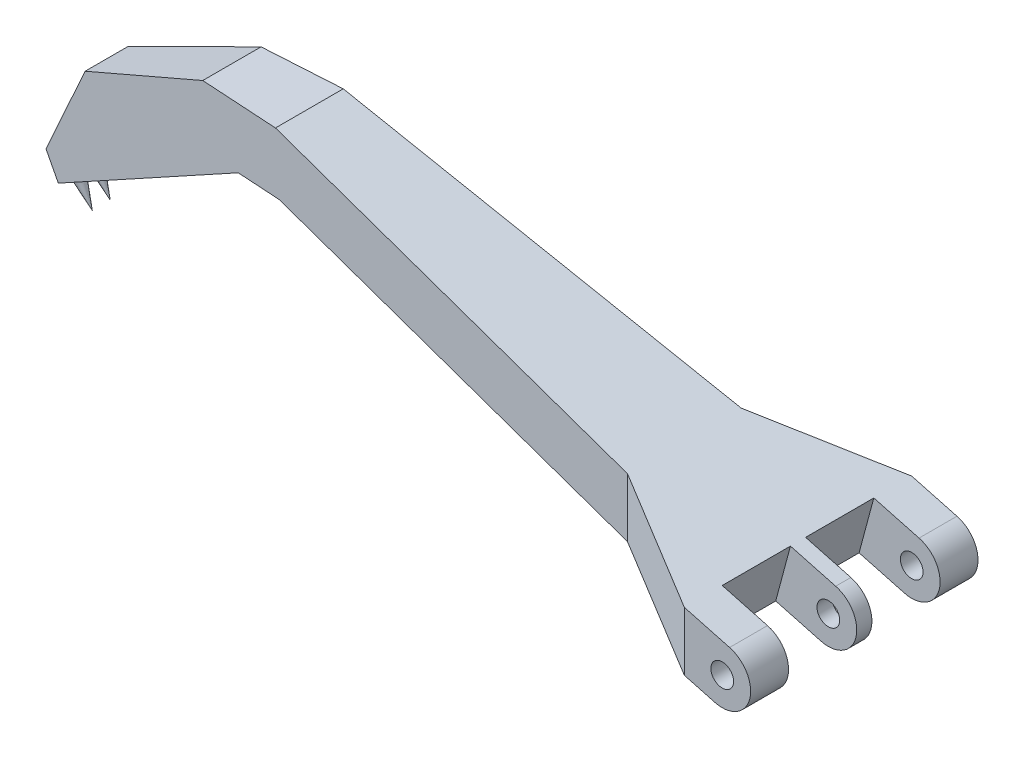
from build123d import *

# Parameters (mm, degrees)
BOSS_EXTRUDE2_DEPTH      = 15
BOSS_EXTRUDE2_DEPTH_BACK = 15
SKETCH3_R                = 1.5
CUT_EXTRUDE2_DEPTH       = 106.264714703
CUT_EXTRUDE2_DEPTH_BACK  = 106.264714703
SKETCH12_OUTSIDE_W       = 130.034
SKETCH12_OUTSIDE_H       = 54.552
BOSS_EXTRUDE3_DEPTH      = 15
BOSS_EXTRUDE3_DEPTH_BACK = 15
SKETCH13_R               = 1.5
CUT_EXTRUDE8_REACH       = 107.495
SKETCH16_W               = 6.181190374
SKETCH16_H               = 9
SKETCH16_W_2             = 3.75


with BuildPart() as part:
    # Sketch3 → Boss-Extrude2 (new, two sides: drawn at the far end of the back side and taken through both)
    with BuildSketch(Plane.XY.offset(-BOSS_EXTRUDE2_DEPTH_BACK)):
        with BuildLine():
            Line((0.970571419, 3.622221849), (-69.482255776, 22.5))
            Line((-69.482255776, 22.5), (-79.701126542, 22.5))
            Line((-79.701126542, 22.5), (-96.234008051, 14.790590741))
            Line((-96.234008051, 14.790590741), (-101.732050808, 3))
            Line((-101.732050808, 3), (-100, 0))
            Line((-100, 0), (-74.714962449, 14.598323237))
            Line((-74.714962449, 14.598323237), (-68.970571419, 14.598323237))
            Line((-68.970571419, 14.598323237), (-0.970571419, -3.622221849))
            ThreePointArc((-0.970571419, -3.622221849), (3.622221849, -0.970571419), (0.970571419, 3.622221849))
        make_face()
        Circle(SKETCH3_R, mode=Mode.SUBTRACT)
    extrude(amount=BOSS_EXTRUDE2_DEPTH + BOSS_EXTRUDE2_DEPTH_BACK)

    # Sketch12 outside → Cut-Extrude2 (cut, two sides: drawn at the far end of the back side and taken through both)
    with BuildSketch(Plane(origin=(0, 0, 0), x_dir=(1, 0, 0), z_dir=(0, 1, 0)).offset(-CUT_EXTRUDE2_DEPTH_BACK)):
        with Locations((-48.991, 0)):
            Rectangle(SKETCH12_OUTSIDE_W, SKETCH12_OUTSIDE_H)
        Polygon((-101.732050808, 2.5), (-101.732050808, -2.5), (-20, -7.5), (-5, -15), (-5, 15), (-20, 7.5), align=None, mode=Mode.SUBTRACT)
    extrude(amount=CUT_EXTRUDE2_DEPTH + CUT_EXTRUDE2_DEPTH_BACK, mode=Mode.SUBTRACT)

    # Sketch13 → Boss-Extrude3 (add, two sides: drawn at the far end of the back side and taken through both)
    with BuildSketch(Plane.XY.offset(-BOSS_EXTRUDE3_DEPTH_BACK)):
        with BuildLine():
            Line((-5, 5.222031639), (-5, -2.542539714))
            Line((-5, -2.542539714), (-0.970571419, -3.622221849))
            ThreePointArc((-0.970571419, -3.622221849), (3.622221849, -0.970571419), (0.970571419, 3.622221849))
            Line((0.970571419, 3.622221849), (-5, 5.222031639))
        make_face()
        Circle(SKETCH13_R, mode=Mode.SUBTRACT)
    extrude(amount=BOSS_EXTRUDE3_DEPTH + BOSS_EXTRUDE3_DEPTH_BACK)

    # Cut-Extrude8: up to this face of the body (flat: up to its plane)
    cut_extrude8_end = Plane(part.part.faces().sort_by_distance((-27.959079365, 3.60932706, 0))[0])
    # Sketch16 → Cut-Extrude8 (cut, up to the picked face)
    with BuildSketch(Plane(origin=(0.970571419, 3.622221849, 0), x_dir=(0.9659258262890683, -0.2588190451025211, 0), z_dir=(0.2588190451025211, 0.9659258262890683, 0)), mode=Mode.PRIVATE) as cut_extrude8_sk1:
        with Locations((-3.090595187, 5.5)):
            Rectangle(SKETCH16_W, SKETCH16_H)
    cut_extrude8_tool1 = split(extrude(cut_extrude8_sk1.sketch, amount=-CUT_EXTRUDE8_REACH, mode=Mode.PRIVATE), bisect_by=cut_extrude8_end, keep=Keep.BOTH, mode=Mode.PRIVATE)
    # Sketch16 → Cut-Extrude8 (cut, up to the picked face)
    with BuildSketch(Plane(origin=(0.970571419, 3.622221849, 0), x_dir=(0.9659258262890683, -0.2588190451025211, 0), z_dir=(0.2588190451025211, 0.9659258262890683, 0)), mode=Mode.PRIVATE) as cut_extrude8_sk2:
        with Locations((-3.090595187, -5.5)):
            Rectangle(SKETCH16_W, SKETCH16_H)
    cut_extrude8_tool2 = split(extrude(cut_extrude8_sk2.sketch, amount=-CUT_EXTRUDE8_REACH, mode=Mode.PRIVATE), bisect_by=cut_extrude8_end, keep=Keep.BOTH, mode=Mode.PRIVATE)
    # Sketch16 → Cut-Extrude8 (cut, up to the picked face)
    with BuildSketch(Plane(origin=(0.970571419, 3.622221849, 0), x_dir=(0.9659258262890683, -0.2588190451025211, 0), z_dir=(0.2588190451025211, 0.9659258262890683, 0)), mode=Mode.PRIVATE) as cut_extrude8_sk3:
        with Locations((1.875, -5.5)):
            Rectangle(SKETCH16_W_2, SKETCH16_H)
    cut_extrude8_tool3 = split(extrude(cut_extrude8_sk3.sketch, amount=-CUT_EXTRUDE8_REACH, mode=Mode.PRIVATE), bisect_by=cut_extrude8_end, keep=Keep.BOTH, mode=Mode.PRIVATE)
    # Sketch16 → Cut-Extrude8 (cut, up to the picked face)
    with BuildSketch(Plane(origin=(0.970571419, 3.622221849, 0), x_dir=(0.9659258262890683, -0.2588190451025211, 0), z_dir=(0.2588190451025211, 0.9659258262890683, 0)), mode=Mode.PRIVATE) as cut_extrude8_sk4:
        with Locations((1.875, 5.5)):
            Rectangle(SKETCH16_W_2, SKETCH16_H)
    cut_extrude8_tool4 = split(extrude(cut_extrude8_sk4.sketch, amount=-CUT_EXTRUDE8_REACH, mode=Mode.PRIVATE), bisect_by=cut_extrude8_end, keep=Keep.BOTH, mode=Mode.PRIVATE)
    add(cut_extrude8_tool1.solids().sort_by(Axis((-2.014714, 4.422127, -5.5), (-0.2588190451025211, -0.9659258262890683, 0)))[0], mode=Mode.SUBTRACT)
    add(cut_extrude8_tool2.solids().sort_by(Axis((-2.014714, 4.422127, 5.5), (-0.2588190451025211, -0.9659258262890683, 0)))[0], mode=Mode.SUBTRACT)
    add(cut_extrude8_tool3.solids().sort_by(Axis((2.781682, 3.136936, 5.5), (-0.2588190451025211, -0.9659258262890683, 0)))[0], mode=Mode.SUBTRACT)
    add(cut_extrude8_tool4.solids().sort_by(Axis((2.781682, 3.136936, -5.5), (-0.2588190451025211, -0.9659258262890683, 0)))[0], mode=Mode.SUBTRACT)

    # Boss-Extrude4 cone 1 section (through the dimple's axis) → Boss-Extrude4 (revolve)
    with BuildSketch(Plane(origin=(-98.700961894, 0.75, 1.183324765), x_dir=(0, 0, 1), z_dir=(0.866025404, 0.5, 0))):
        Polygon((0, 0), (0.75, 0), (0, 3.528472582), align=None)
    revolve(axis=Axis((-98.700961894, 0.75, 1.183324765), (0.5, -0.866025404, 0)))

    # Boss-Extrude4 cone 2 section (through the dimple's axis) → Boss-Extrude4 cone 2 (revolve)
    with BuildSketch(Plane(origin=(-98.700961894, 0.75, -1.183324765), x_dir=(0, 0, 1), z_dir=(0.866025404, 0.5, 0))):
        Polygon((0, 0), (0.75, 0), (0, 3.528472582), align=None)
    revolve(axis=Axis((-98.700961894, 0.75, -1.183324765), (0.5, -0.866025404, 0)))


solid = part.part
